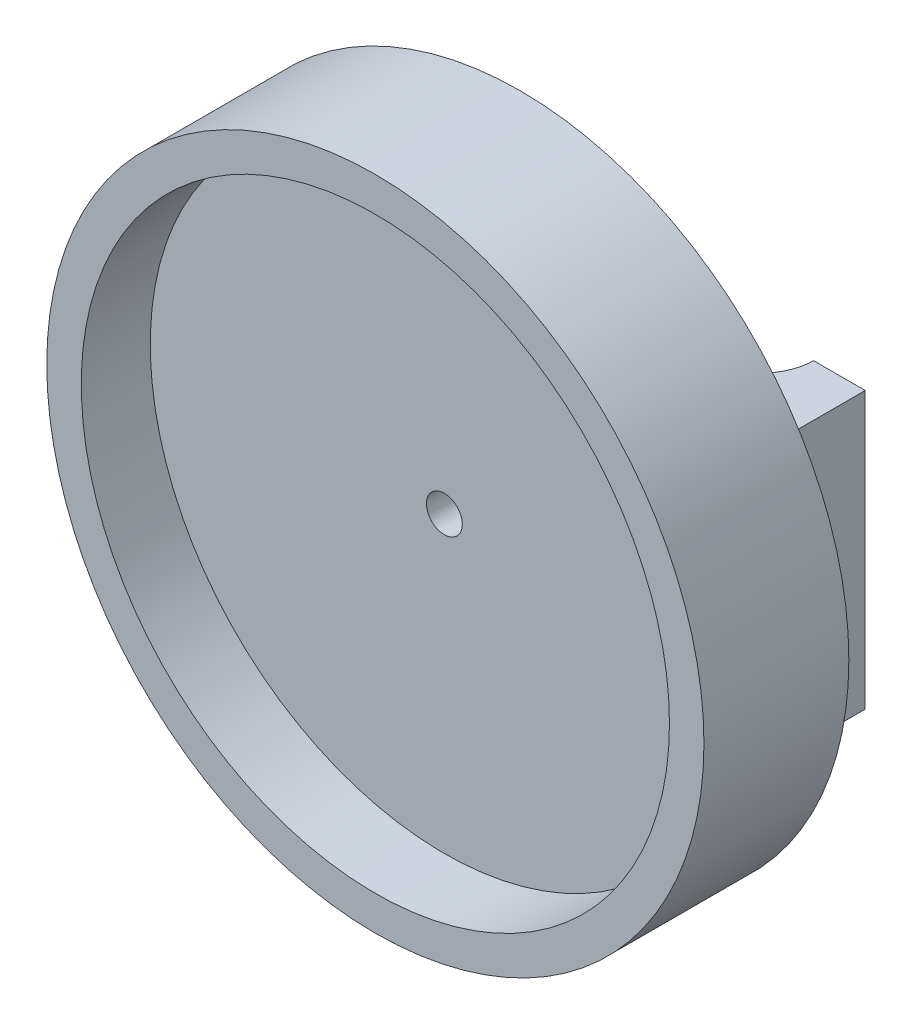
from build123d import *

# Parameters (mm, degrees)
SKETCH1_R           = 47.625
BOSS_EXTRUDE1_DEPTH = 21
SKETCH2_R           = 42.625
CUT_EXTRUDE1_DEPTH  = 10
SKETCH3_W           = 70
SKETCH3_H           = 40
BOSS_EXTRUDE2_DEPTH = 15
SKETCH4_R           = 7.5
CUT_EXTRUDE2_DEPTH  = 86.336283315
SKETCH5_R           = 2.6
CUT_EXTRUDE3_DEPTH  = 77.36937377
SKETCH6_R           = 11.5
CUT_EXTRUDE4_DEPTH  = 16.5


with BuildPart() as part:
    # Sketch1 → Boss-Extrude1 (new body)
    with BuildSketch(Plane.XY):
        with Locations(Location((0, 0, 0), (0, 0, 180))):
            Circle(SKETCH1_R)
    extrude(amount=BOSS_EXTRUDE1_DEPTH)

    # Sketch2 → Cut-Extrude1 (cut)
    with BuildSketch(Plane.XY.offset(21)):
        Circle(SKETCH2_R)
    extrude(amount=-CUT_EXTRUDE1_DEPTH, mode=Mode.SUBTRACT)

    # Sketch3 → Boss-Extrude2 (add)
    with BuildSketch(Plane(origin=(0, 0, 0), x_dir=(-1, 0, 0), z_dir=(0, 0, -1))):
        Rectangle(SKETCH3_W, SKETCH3_H)
    extrude(amount=BOSS_EXTRUDE2_DEPTH)

    # Sketch4 → Cut-Extrude2 (cut, through all)
    with BuildSketch(Plane(origin=(0, 20, 0), x_dir=(-1, 0, 0), z_dir=(0, 1, 0))):
        with Locations((-20, -15)):
            Circle(SKETCH4_R)
        with Locations((20, -15)):
            Circle(SKETCH4_R)
    extrude(amount=-CUT_EXTRUDE2_DEPTH, mode=Mode.SUBTRACT)

    # Sketch5 → Cut-Extrude3 (cut, through all)
    with BuildSketch(Plane(origin=(0, 0, -15), x_dir=(-1, 0, 0), z_dir=(0, 0, -1))):
        Circle(SKETCH5_R)
    extrude(amount=-CUT_EXTRUDE3_DEPTH, mode=Mode.SUBTRACT)

    # Sketch6 → Cut-Extrude4 (cut, symmetric)
    with BuildSketch(Plane(origin=(0, 0, 0), x_dir=(1, 0, 0), z_dir=(0, 1, 0))):
        with Locations((-20, 15)):
            Circle(SKETCH6_R)
        with Locations((20, 15)):
            Circle(SKETCH6_R)
    extrude(amount=CUT_EXTRUDE4_DEPTH, both=True, mode=Mode.SUBTRACT)


solid = part.part
